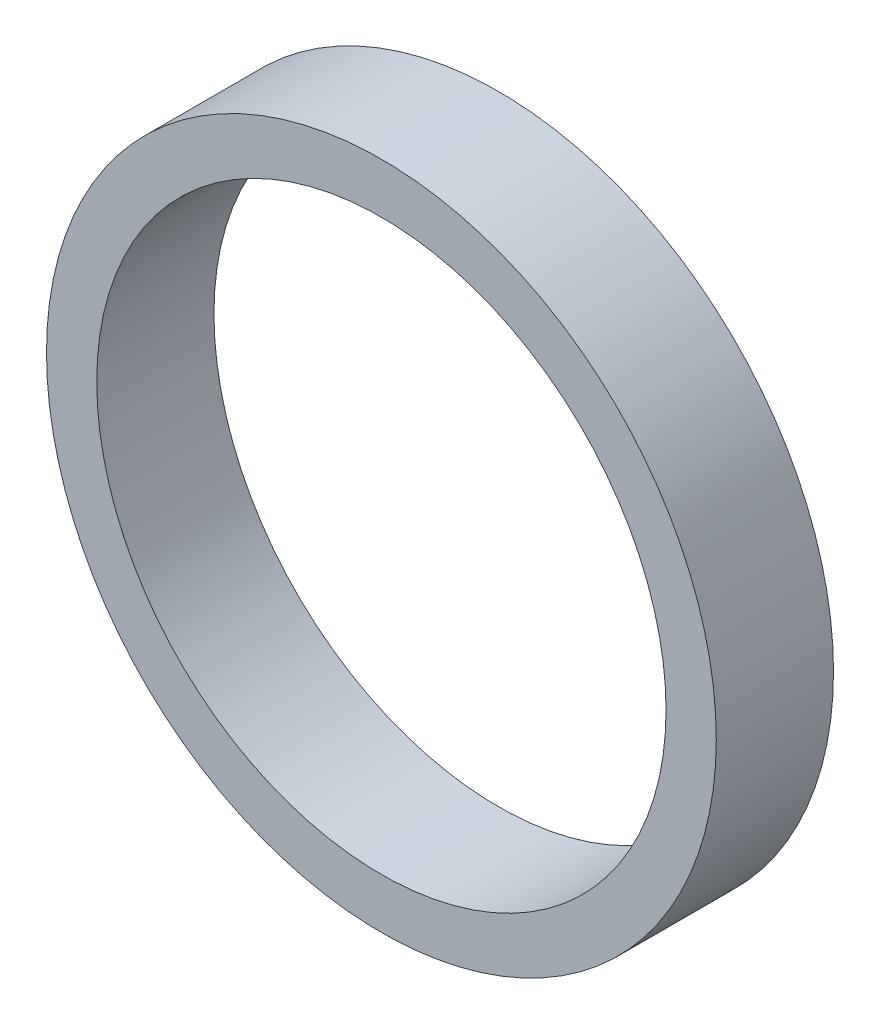
from build123d import *

# Parameters (mm, degrees)
SKETCH1_R           = 20
SKETCH1_R_2         = 17
BOSS_EXTRUDE1_DEPTH = 7


with BuildPart() as part:
    # Sketch1 → Boss-Extrude1 (new body)
    with BuildSketch(Plane.XY):
        Circle(SKETCH1_R)
        Circle(SKETCH1_R_2, mode=Mode.SUBTRACT)
    extrude(amount=BOSS_EXTRUDE1_DEPTH)


solid = part.part
